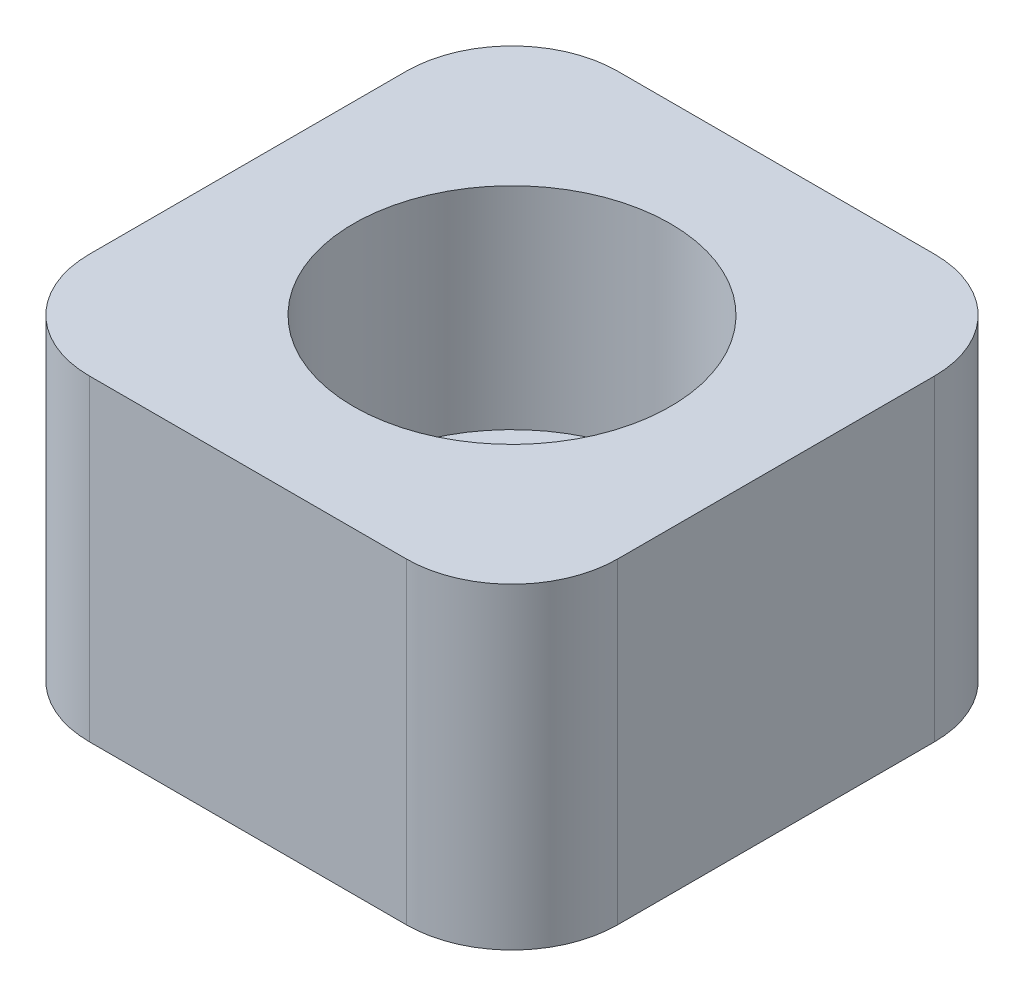
from build123d import *

# Parameters (mm, degrees)
SKETCH1_W           = 50
SKETCH1_H           = 50
BOSS_EXTRUDE1_DEPTH = 30
SKETCH2_R           = 15
CUT_EXTRUDE1_DEPTH  = 20
FILLET1_R           = 10
SKETCH3_R           = 3
CUT_EXTRUDE2_DEPTH  = 10


with BuildPart() as part:
    # Sketch1 → Boss-Extrude1 (new body)
    with BuildSketch(Plane(origin=(0, 0, 0), x_dir=(1, 0, 0), z_dir=(0, 1, 0))):
        Rectangle(SKETCH1_W, SKETCH1_H)
    extrude(amount=BOSS_EXTRUDE1_DEPTH)

    # Sketch2 → Cut-Extrude1 (cut)
    with BuildSketch(Plane(origin=(0, 30, 0), x_dir=(1, 0, 0), z_dir=(0, 1, 0))):
        with Locations(Location((0, 0, 0), (0, 0, 270))):
            Circle(SKETCH2_R)
    extrude(amount=-CUT_EXTRUDE1_DEPTH, mode=Mode.SUBTRACT)

    # Fillet1
    fillet1_edges = [part.edges().sort_by_distance(p)[0] for p in [
        (25, 15, 25),
        (-25, 15, 25),
        (-25, 15, -25),
        (25, 15, -25),
    ]]
    fillet(fillet1_edges, radius=FILLET1_R)

    # Sketch3 → Cut-Extrude2 (cut)
    with BuildSketch(Plane.XZ):
        with Locations(Location((15, -15, 0), (0, 0, 270))):
            Circle(SKETCH3_R)
        with Locations(Location((-15, -15, 0), (0, 0, 270))):
            Circle(SKETCH3_R)
        with Locations(Location((-15, 15, 0), (0, 0, 270))):
            Circle(SKETCH3_R)
        with Locations(Location((15, 15, 0), (0, 0, 270))):
            Circle(SKETCH3_R)
    extrude(amount=-CUT_EXTRUDE2_DEPTH, mode=Mode.SUBTRACT)


solid = part.part
